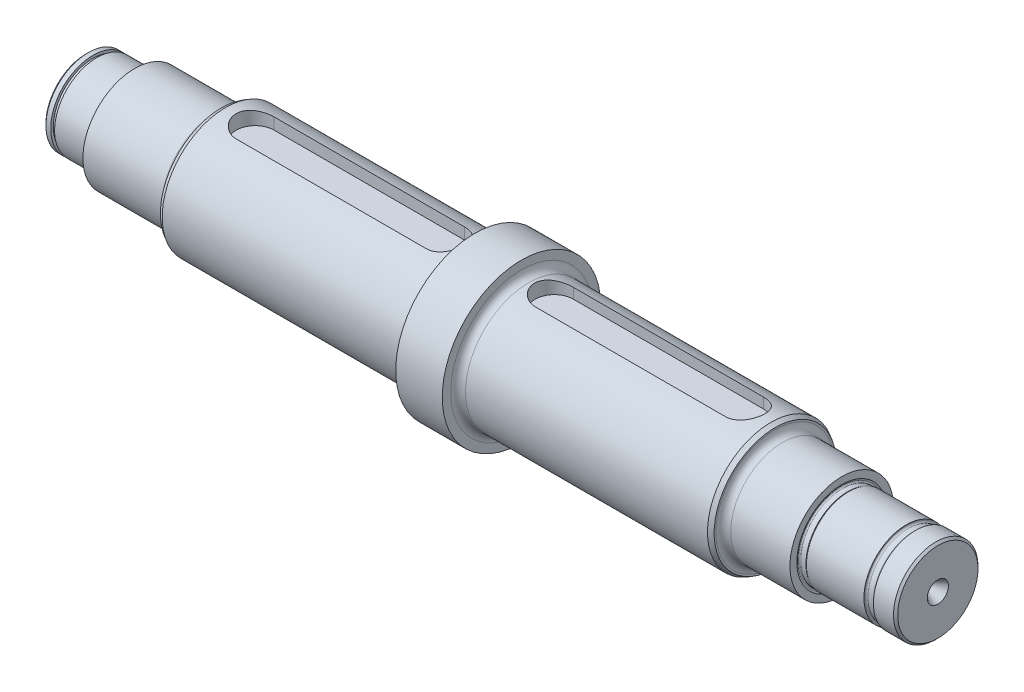
from build123d import *

# Parameters (mm, degrees)
CUT_EXTRUDE1_DEPTH = 6.8


with BuildPart() as part:
    # Sketch1 → Revolve2 (revolve)
    with BuildSketch(Plane.XY, mode=Mode.PRIVATE) as revolve2_sk:
        with BuildLine():
            Line((-392.8, 0), (-10.2, 0))
            Line((-10.2, 0), (-9, 2))
            Line((-9, 2), (-5, 2))
            Line((-5, 2), (0, 5))
            Line((0, 5), (0, 19))
            Line((0, 19), (-1, 20))
            Line((-1, 20), (-10.51, 20))
            Line((-10.51, 20), (-10.971880215, 19.2))
            ThreePointArc((-10.971880215, 19.2), (-11.264700538, 18.907179677), (-11.664700538, 18.8))
            Line((-11.664700538, 18.8), (-14.2, 18.8))
            ThreePointArc((-14.2, 18.8), (-14.765685425, 19.034314575), (-15, 19.6))
            Line((-15, 19.6), (-15, 20))
            Line((-15, 20), (-42.2, 20))
            Line((-42.2, 20), (-42.719615242, 19.7))
            Line((-42.719615242, 19.7), (-45.2, 19.7))
            ThreePointArc((-45.2, 19.7), (-45.691491227, 19.955854138), (-45.763815572, 20.505212086))
            Line((-45.763815572, 20.505212086), (-45.5, 21.230039414))
            Line((-45.5, 21.230039414), (-45.5, 23.217650241))
            Line((-45.5, 23.217650241), (-45.5, 24.5))
            Line((-45.5, 24.5), (-73.5, 24.5))
            ThreePointArc((-73.5, 24.5), (-75.974873734, 25.525126266), (-77, 28))
            Line((-77, 28), (-77, 28.845299462))
            Line((-77, 28.845299462), (-79, 30))
            Line((-79, 30), (-193.5, 30))
            ThreePointArc((-193.5, 30), (-195.974873734, 31.025126266), (-197, 33.5))
            Line((-197, 33.5), (-197, 37.5))
            Line((-197, 37.5), (-219, 37.5))
            Line((-219, 37.5), (-219, 33.5))
            ThreePointArc((-219, 33.5), (-220.025126266, 31.025126266), (-222.5, 30))
            Line((-222.5, 30), (-337, 30))
            Line((-337, 30), (-339, 28.845299462))
            Line((-339, 28.845299462), (-339, 28))
            ThreePointArc((-339, 28), (-340.025126266, 25.525126266), (-342.5, 24.5))
            Line((-342.5, 24.5), (-380, 24.5))
            Line((-380, 24.5), (-380, 21.2))
            ThreePointArc((-380, 21.2), (-380.829179607, 19.858359214), (-382.4, 20))
            Line((-382.4, 20), (-397.9, 20))
            Line((-397.9, 20), (-397.9, 18.75))
            Line((-397.9, 18.75), (-399.75, 18.75))
            Line((-399.75, 18.75), (-399.75, 20))
            Line((-399.75, 20), (-402, 20))
            Line((-402, 20), (-403, 19))
            Line((-403, 19), (-403, 5))
            Line((-403, 5), (-398, 2))
            Line((-398, 2), (-394, 2))
            Line((-394, 2), (-392.8, 0))
        make_face()
    revolve(revolve2_sk.sketch.rotate(Axis((-10.2, 0, 0), (-1, 0, 0)), 90), axis=Axis((-10.2, 0, 0), (-1, 0, 0)))

    # Sketch2 → Cut-Extrude1 (cut)
    with BuildSketch(Plane(origin=(0, 30, 0), x_dir=(1, 0, 0), z_dir=(0, 1, 0))):
        with BuildLine():
            Line((-323, 9), (-233, 9))
            ThreePointArc((-233, 9), (-224, 0), (-233, -9))
            Line((-233, -9), (-323, -9))
            ThreePointArc((-323, -9), (-332, 0), (-323, 9))
        make_face()
        with BuildLine():
            Line((-183, 10.524530011), (-93, 10.524530011))
            ThreePointArc((-93, 10.524530011), (-84, 1.524530011), (-93, -7.475469989))
            Line((-93, -7.475469989), (-183, -7.475469989))
            ThreePointArc((-183, -7.475469989), (-192, 1.524530011), (-183, 10.524530011))
        make_face()
    extrude(amount=-CUT_EXTRUDE1_DEPTH, mode=Mode.SUBTRACT)


solid = part.part
